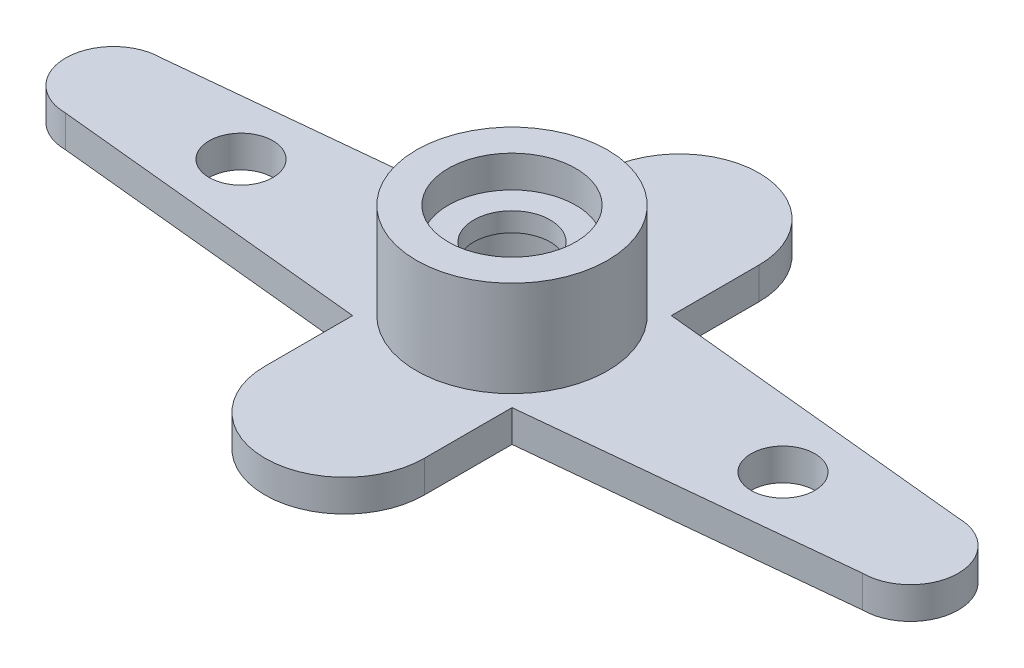
from build123d import *

# Parameters (mm, degrees)
SKETCH1_R           = 10
BOSS_EXTRUDE1_DEPTH = 2.5
SKETCH2_R           = 15
SKETCH2_R_2         = 10
BOSS_EXTRUDE2_DEPTH = 15
SKETCH3_R           = 5
CUT_EXTRUDE1_DEPTH  = 82.403700776
BOSS_EXTRUDE3_START = 9.5
SKETCH4_R           = 10
SKETCH4_R_2         = 6
BOSS_EXTRUDE3_DEPTH = 3


with BuildPart() as part:
    # Sketch1 → Boss-Extrude1 (new, symmetric)
    with BuildSketch(Plane(origin=(0, 0, 0), x_dir=(1, 0, 0), z_dir=(0, 1, 0))):
        with BuildLine():
            Line((12.5, 12.5), (12.5, 26.25))
            ThreePointArc((12.5, 26.25), (0, 38.75), (-12.5, 26.25))
            Line((-12.5, 26.25), (-12.5, 12.5))
            Line((-12.5, 12.5), (-62.5, 7.5))
            ThreePointArc((-62.5, 7.5), (-70, 0), (-62.5, -7.5))
            Line((-62.5, -7.5), (-12.5, -12.5))
            Line((-12.5, -12.5), (-12.5, -26.25))
            ThreePointArc((-12.5, -26.25), (0, -38.75), (12.5, -26.25))
            Line((12.5, -26.25), (12.5, -12.5))
            Line((12.5, -12.5), (62.5, -7.5))
            ThreePointArc((62.5, -7.5), (70, 0), (62.5, 7.5))
            Line((62.5, 7.5), (12.5, 12.5))
        make_face()
        with Locations(Location((0, 0, 0), (0, 0, 270))):
            Circle(SKETCH1_R, mode=Mode.SUBTRACT)
    extrude(amount=BOSS_EXTRUDE1_DEPTH, both=True)

    # Sketch2 → Boss-Extrude2 (add)
    with BuildSketch(Plane(origin=(0, 2.5, 0), x_dir=(1, 0, 0), z_dir=(0, 1, 0))):
        with Locations(Location((0, 0, 0), (0, 0, 90))):
            Circle(SKETCH2_R)
        with Locations(Location((0, 0, 0), (0, 0, 270))):
            Circle(SKETCH2_R_2, mode=Mode.SUBTRACT)
    extrude(amount=BOSS_EXTRUDE2_DEPTH)

    # Sketch3 → Cut-Extrude1 (cut, through all)
    with BuildSketch(Plane(origin=(0, 2.5, 0), x_dir=(1, 0, 0), z_dir=(0, 1, 0))):
        with Locations(Location((42.5, 0, 0), (0, 0, 270))):
            Circle(SKETCH3_R)
        with Locations(Location((-42.5, 0, 0), (0, 0, 270))):
            Circle(SKETCH3_R)
    extrude(amount=-CUT_EXTRUDE1_DEPTH, mode=Mode.SUBTRACT)

    # Sketch4 → Boss-Extrude3 (add)
    with BuildSketch(Plane(origin=(0, 0, 0), x_dir=(1, 0, 0), z_dir=(0, 1, 0)).offset(BOSS_EXTRUDE3_START)):
        with Locations(Location((0, 0, 0), (0, 0, 270))):
            Circle(SKETCH4_R)
        with Locations(Location((0, 0, 0), (0, 0, 270))):
            Circle(SKETCH4_R_2, mode=Mode.SUBTRACT)
    extrude(amount=BOSS_EXTRUDE3_DEPTH)


solid = part.part
